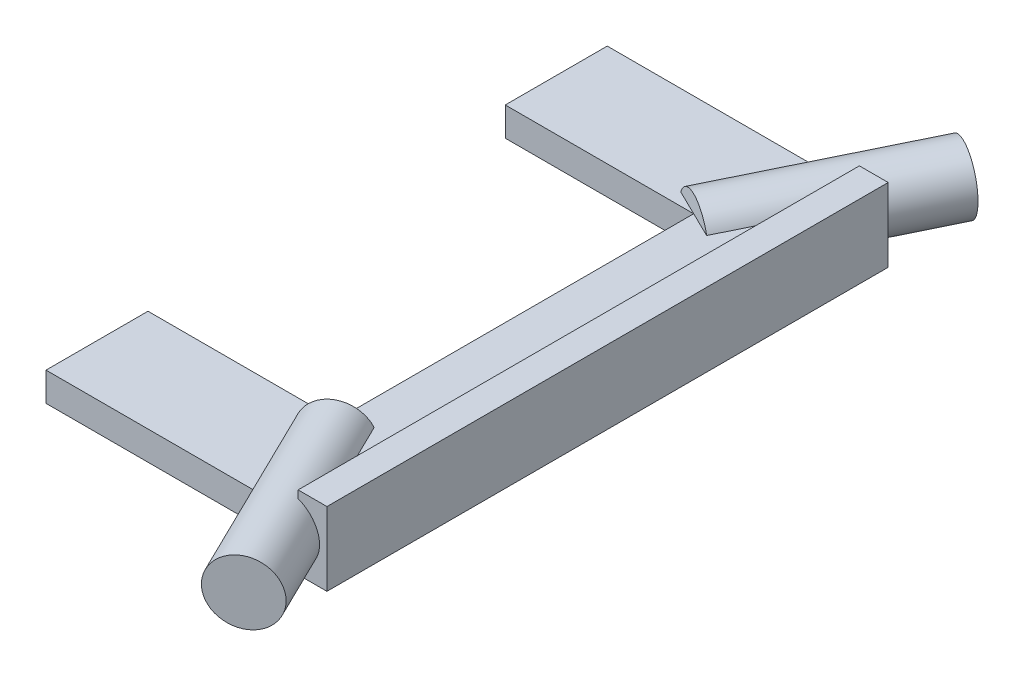
from build123d import *

# Parameters (mm, degrees)
SKETCH1_W               = 72.11
SKETCH1_H               = 97.4
BOSS_EXTRUDE1_DEPTH     = 2.5
SKETCH2_W               = 5
SKETCH2_H               = 97.4
BOSS_EXTRUDE2_DEPTH     = 6.375
CUT_EXTRUDE1_DEPTH      = 62.240661737
CUT_EXTRUDE1_DEPTH_BACK = 62.240661737
SKETCH3_W               = 40
SKETCH3_H               = 62
CUT_EXTRUDE2_DEPTH      = 77.631155751
CUT_EXTRUDE2_DEPTH_BACK = 77.631155751
SKETCH5_W               = 31.75
SKETCH5_H               = 152.4


with BuildPart() as part:
    # Sketch1 → Boss-Extrude1 (new, symmetric)
    with BuildSketch(Plane(origin=(0, 0, 0), x_dir=(1, 0, 0), z_dir=(0, 1, 0))):
        Rectangle(SKETCH1_W, SKETCH1_H)
    extrude(amount=BOSS_EXTRUDE1_DEPTH, both=True)

    # Sketch2 → Boss-Extrude2 (add, symmetric)
    with BuildSketch(Plane(origin=(0, 0, 0), x_dir=(1, 0, 0), z_dir=(0, 1, 0))):
        with Locations((-33.555, 0)):
            Rectangle(SKETCH2_W, SKETCH2_H)
        with Locations((33.555, 0)):
            Rectangle(SKETCH2_W, SKETCH2_H)
    extrude(amount=BOSS_EXTRUDE2_DEPTH, both=True)

    # Sketch3 → Cut-Extrude1 (cut, two sides: drawn at the far end of the back side and taken through both)
    with BuildSketch(Plane(origin=(0, 2.5, 0), x_dir=(1, 0, 0), z_dir=(0, 1, 0)).offset(-CUT_EXTRUDE1_DEPTH_BACK)):
        Rectangle(SKETCH3_W, SKETCH3_H)
    extrude(amount=CUT_EXTRUDE1_DEPTH + CUT_EXTRUDE1_DEPTH_BACK, mode=Mode.SUBTRACT)

    # Sketch4 → Revolve1 (revolve)
    with BuildSketch(Plane(origin=(0, 0, 0), x_dir=(1, 0, 0), z_dir=(0, 1, 0)), mode=Mode.PRIVATE) as revolve1_sk:
        Polygon((20, 31), (15.058430503, 33.414723774), (30.424854519, 64.86107512), (35.366424016, 62.446351346), align=None)
    revolve1 = revolve(revolve1_sk.sketch.rotate(Axis((20, 0, -31), (0.4390406861851917, 0, -0.8984671813004836)), 180), axis=Axis((20, 0, -31), (0.4390406861851917, 0, -0.8984671813004836)))

    # Mirror1: Revolve1 across plane
    add(revolve1.mirror(Plane.XY))

    # Sketch5 → Cut-Extrude2 (cut, two sides: drawn at the far end of the back side and taken through both)
    with BuildSketch(Plane(origin=(0, 0, 0), x_dir=(1, 0, 0), z_dir=(0, 1, 0)).offset(-CUT_EXTRUDE2_DEPTH_BACK)):
        with Locations((-28.575, 0)):
            Rectangle(SKETCH5_W, SKETCH5_H)
    extrude(amount=CUT_EXTRUDE2_DEPTH + CUT_EXTRUDE2_DEPTH_BACK, mode=Mode.SUBTRACT)


solid = part.part
